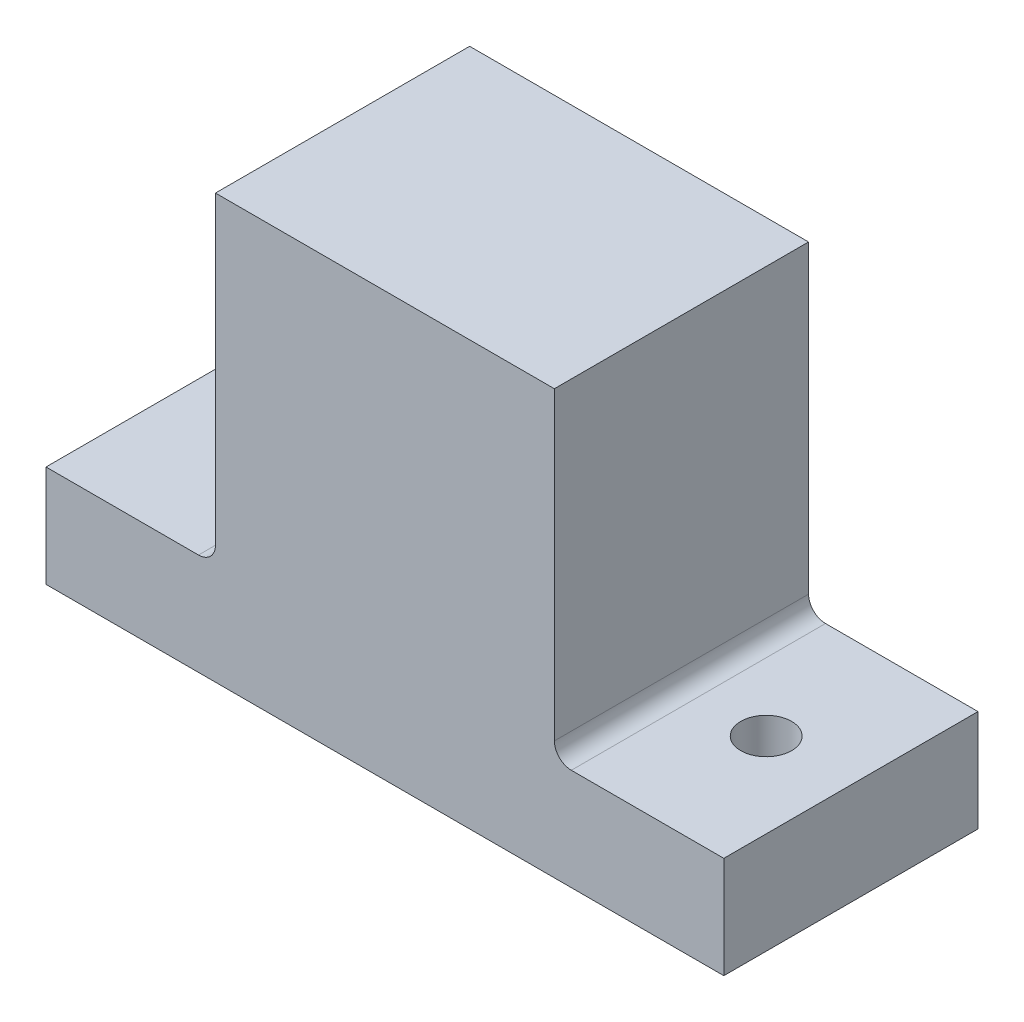
from build123d import *

# Parameters (mm, degrees)
EXTRUDE_1_DEPTH     = 15
SKETCH_2_R          = 1.5
CUT_EXTRUDE_1_DEPTH = 32.400636936
FILLET_1_R          = 1


with BuildPart() as part:
    # 草图1 → 凸台-拉伸1 (new body)
    with BuildSketch(Plane.XY):
        Polygon((20, 0), (-20, 0), (-20, 6), (-10, 6), (-10, 25), (10, 25), (10, 6), (20, 6), align=None)
    extrude(amount=EXTRUDE_1_DEPTH)

    # 草图2 → 切除-拉伸1 (cut, through all)
    with BuildSketch(Plane(origin=(0, 6, 0), x_dir=(1, 0, 0), z_dir=(0, 1, 0))):
        with Locations(Location((-15, -7.5, 0), (0, 0, 180))):
            Circle(SKETCH_2_R)
        with Locations((15, -7.5)):
            Circle(SKETCH_2_R)
    extrude(amount=-CUT_EXTRUDE_1_DEPTH, mode=Mode.SUBTRACT)

    # 圆角1
    fillet_1_edges = [part.edges().sort_by_distance(p)[0] for p in [
        (-10, 6, 7.5),
        (10, 6, 7.5),
    ]]
    fillet(fillet_1_edges, radius=FILLET_1_R)


solid = part.part
